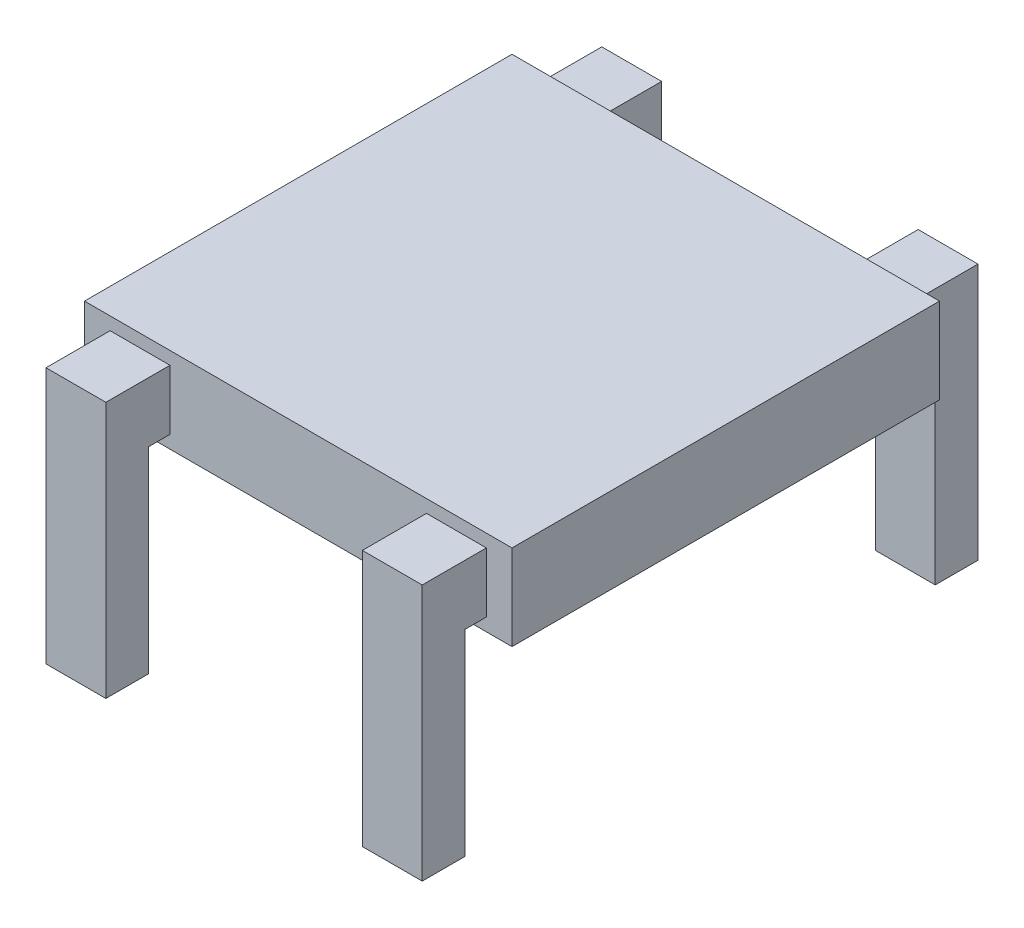
from build123d import *

# Parameters (mm, degrees)
SKETCH1_W           = 5
SKETCH1_H           = 5
BOSS_EXTRUDE1_DEPTH = 1
SKETCH2_W           = 0.7
SKETCH2_H           = 0.7
BOSS_EXTRUDE2_DEPTH = 0.5
SKETCH7_W           = 0.7
SKETCH7_H           = 0.5
BOSS_EXTRUDE3_DEPTH = 3
SKETCH8_W           = 0.7
SKETCH8_H           = 0.7
BOSS_EXTRUDE4_DEPTH = 0.5
SKETCH9_W           = 0.7
SKETCH9_H           = 0.5
BOSS_EXTRUDE5_DEPTH = 3


with BuildPart() as part:
    # Sketch1 → Boss-Extrude1 (new body)
    with BuildSketch(Plane(origin=(0, 0, 0), x_dir=(1, 0, 0), z_dir=(0, 1, 0))):
        Rectangle(SKETCH1_W, SKETCH1_H)
    extrude(amount=BOSS_EXTRUDE1_DEPTH)

    # Sketch2 → Boss-Extrude2 (add)
    with BuildSketch(Plane.XY.offset(2.5)):
        with Locations((-1.85, 0.5)):
            Rectangle(SKETCH2_W, SKETCH2_H)
        with Locations((1.85, 0.5)):
            Rectangle(SKETCH2_W, SKETCH2_H)
    extrude(amount=BOSS_EXTRUDE2_DEPTH)

    # Sketch7 → Boss-Extrude3 (add)
    with BuildSketch(Plane(origin=(0, 0.85, 0), x_dir=(1, 0, 0), z_dir=(0, 1, 0))):
        with Locations((-1.85, -3)):
            Rectangle(SKETCH7_W, SKETCH7_H)
        with Locations((1.85, -3)):
            Rectangle(SKETCH7_W, SKETCH7_H)
    extrude(amount=-BOSS_EXTRUDE3_DEPTH)

    # Sketch8 → Boss-Extrude4 (add)
    with BuildSketch(Plane(origin=(0, 0, -2.5), x_dir=(-1, 0, 0), z_dir=(0, 0, -1))):
        with Locations((-1.85, 0.5)):
            Rectangle(SKETCH8_W, SKETCH8_H)
        with Locations((1.85, 0.5)):
            Rectangle(SKETCH8_W, SKETCH8_H)
    extrude(amount=BOSS_EXTRUDE4_DEPTH)

    # Sketch9 → Boss-Extrude5 (add)
    with BuildSketch(Plane(origin=(0, 0.85, 0), x_dir=(1, 0, 0), z_dir=(0, 1, 0))):
        with Locations((-1.85, 3)):
            Rectangle(SKETCH9_W, SKETCH9_H)
        with Locations((1.85, 3)):
            Rectangle(SKETCH9_W, SKETCH9_H)
    extrude(amount=-BOSS_EXTRUDE5_DEPTH)


solid = part.part
